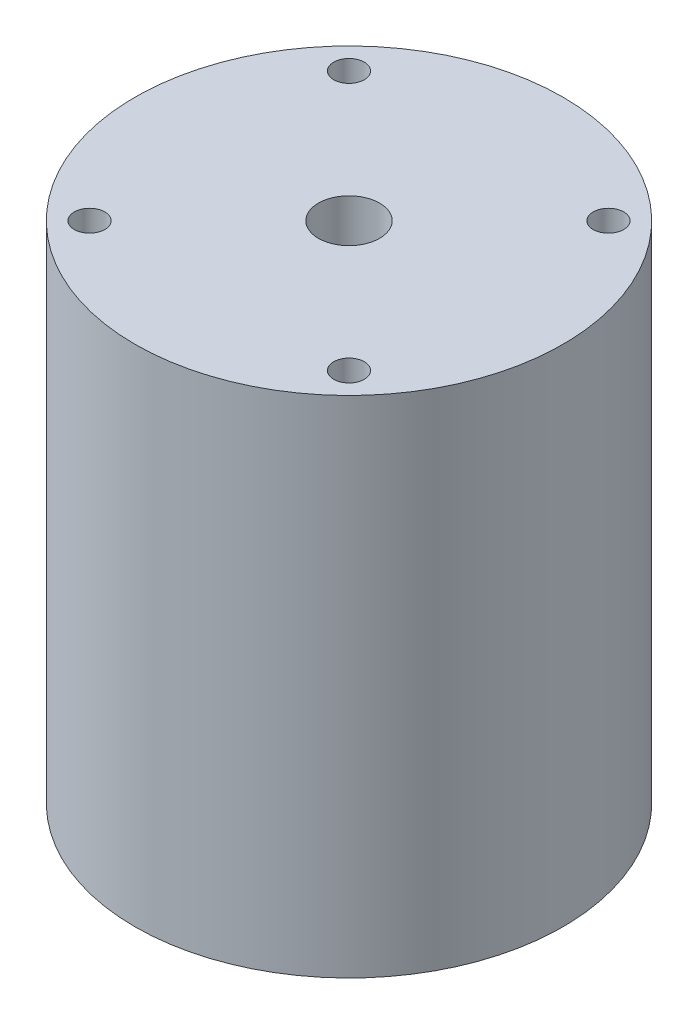
from build123d import *

# Parameters (mm, degrees)
SKETCH_1_R          = 28
EXTRUDE_1_DEPTH     = 66
MM_1_D              = 4
MM_1_DEPTH          = 15
MM_1_TIP            = 1.201721238
SKETCH_5_R          = 4
CUT_EXTRUDE_1_DEPTH = 77.96752562
MM_2_D              = 4
MM_2_DEPTH          = 15
MM_2_TIP            = 1.201721238


with BuildPart() as part:
    # 草图1 → 凸台-拉伸1 (new body)
    with BuildSketch(Plane(origin=(0, 0, 0), x_dir=(1, 0, 0), z_dir=(0, 1, 0))):
        with Locations(Location((0, 0, 0), (0, 0, 270))):
            Circle(SKETCH_1_R)
    extrude(amount=EXTRUDE_1_DEPTH)

    # 大小mm 暗销孔1
    with Locations(Plane(origin=(-16.970562748, 66, -16.970562748), x_dir=(0, 0, 1), z_dir=(0, 1, 0))):
        with Locations((0, 0), (0, 33.941125496), (33.941125496, 33.941125496), (33.941125496, 0)):
            Hole(MM_1_D / 2, depth=MM_1_DEPTH)
            with Locations((0, 0, -(MM_1_DEPTH + MM_1_TIP / 2))):  # 118° drill point
                Cone(0, MM_1_D / 2, MM_1_TIP, mode=Mode.SUBTRACT)

    # 草图5 → 切除-拉伸1 (cut, through all)
    with BuildSketch(Plane(origin=(0, 66, 0), x_dir=(1, 0, 0), z_dir=(0, 1, 0))):
        with Locations(Location((0, 0, 0), (0, 0, 270))):
            Circle(SKETCH_5_R)
    extrude(amount=-CUT_EXTRUDE_1_DEPTH, mode=Mode.SUBTRACT)

    # 大小mm 暗销孔2
    with Locations(Plane(origin=(-8.5, 0, 20.5), x_dir=(0, 0, -1), z_dir=(0, -1, 0))):
        with Locations((0, 0), (0, 17), (41, 17), (41, 0)):
            Hole(MM_2_D / 2, depth=MM_2_DEPTH)
            with Locations((0, 0, -(MM_2_DEPTH + MM_2_TIP / 2))):  # 118° drill point
                Cone(0, MM_2_D / 2, MM_2_TIP, mode=Mode.SUBTRACT)


solid = part.part
